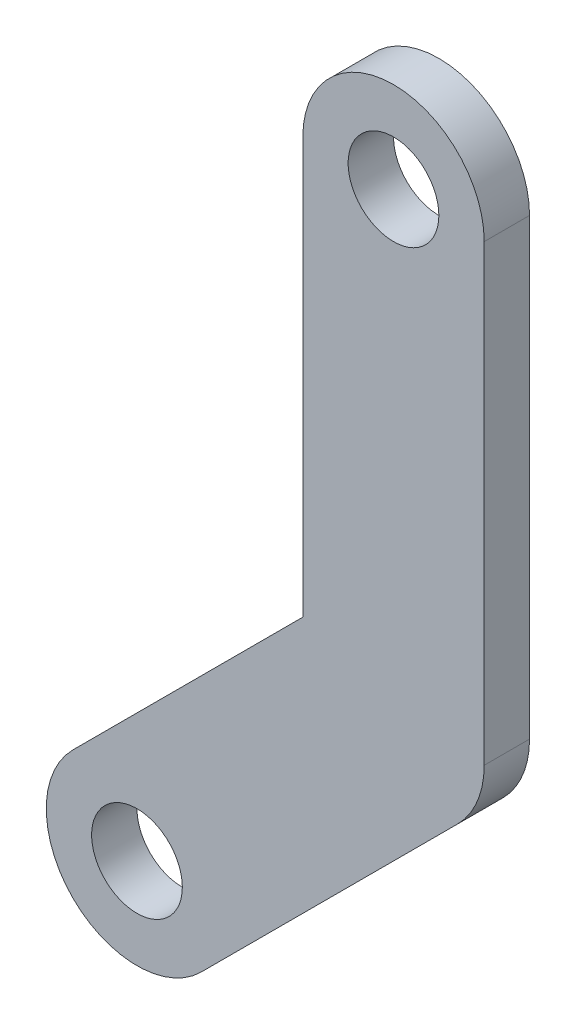
from build123d import *

# Parameters (mm, degrees)
ESQUISSE1_R        = 10
BOSS_EXTRU_1_DEPTH = 10


with BuildPart() as part:
    # Esquisse1 → Boss.-Extru.1 (new body)
    # profile 1 of 3: a face of its own
    with BuildSketch(Plane.XY):
        with BuildLine():
            Line((36.568542495, 156.568542495), (36.568542495, 64.852813742))
            Line((36.568542495, 64.852813742), (42.426406871, 70.710678119))
            ThreePointArc((42.426406871, 70.710678119), (64.222211142, 75.046133145), (76.568542495, 56.568542495))
            Line((76.568542495, 56.568542495), (76.568542495, 156.568542495))
            ThreePointArc((76.568542495, 156.568542495), (56.568542495, 176.568542495), (36.568542495, 156.568542495))
        make_face()
        with Locations((56.568542495, 156.568542495)):
            Circle(ESQUISSE1_R, mode=Mode.SUBTRACT)
    # profile 2 of 3: a face of its own
    with BuildSketch(Plane.XY):
        with BuildLine():
            Line((42.426406871, 70.710678119), (36.568542495, 64.852813742))
            Line((36.568542495, 64.852813742), (36.568542495, 56.568542495))
            ThreePointArc((36.568542495, 56.568542495), (48.914873848, 38.090951845), (70.710678119, 42.426406871))
            ThreePointArc((70.710678119, 42.426406871), (75.046133145, 48.914873848), (76.568542495, 56.568542495))
            ThreePointArc((76.568542495, 56.568542495), (64.222211142, 75.046133145), (42.426406871, 70.710678119))
        make_face()
    # profile 3 of 3: a face of its own
    with BuildSketch(Plane.XY):
        with BuildLine():
            Line((36.568542495, 64.852813742), (-14.142135624, 14.142135624))
            ThreePointArc((-14.142135624, 14.142135624), (-14.142135624, -14.142135624), (14.142135624, -14.142135624))
            Line((14.142135624, -14.142135624), (70.710678119, 42.426406871))
            ThreePointArc((70.710678119, 42.426406871), (48.914873848, 38.090951845), (36.568542495, 56.568542495))
            Line((36.568542495, 56.568542495), (36.568542495, 64.852813742))
        make_face()
        Circle(ESQUISSE1_R, mode=Mode.SUBTRACT)
    extrude(amount=BOSS_EXTRU_1_DEPTH)


solid = part.part
